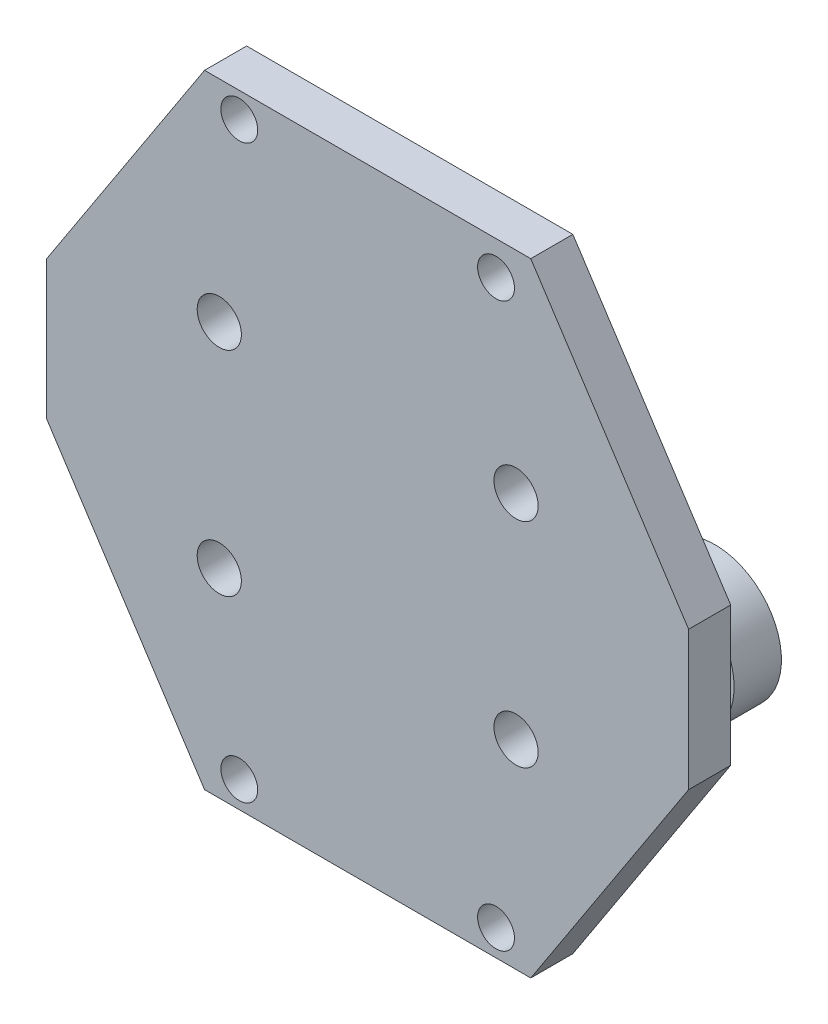
from build123d import *

# Parameters (mm, degrees)
CROQUIS1_W               = 22
CROQUIS1_H               = 55.2
SALIENTE_EXTRUIR1_DEPTH  = 4
CROQUIS2_W               = 12.1
CROQUIS2_H               = 4
CORTAR_EXTRUIR1_DEPTH    = 9.6
CROQUIS3_W               = 12.1
CROQUIS3_H               = 4
CORTAR_EXTRUIR2_DEPTH    = 9.6
CORTAR_EXTRUIR3_DEPTH    = 16
CORTAR_EXTRUIR4_START    = -16
CORTAR_EXTRUIR4_DEPTH    = 16
CROQUIS9_W               = 11.778481694
CROQUIS9_H               = 4
CORTAR_EXTRUIR5_DEPTH    = 2
CROQUIS11_W              = 4.95
CROQUIS11_H              = 4
SALIENTE_EXTRUIR3_DEPTH  = 2
CROQUIS12_W              = 4
CROQUIS12_H              = 1.8
SALIENTE_EXTRUIR4_DEPTH  = 12.1
CROQUIS13_W              = 4.95
CROQUIS13_H              = 4
SALIENTE_EXTRUIR5_DEPTH  = 2
CROQUIS14_W              = 4
CROQUIS14_H              = 1.8
SALIENTE_EXTRUIR6_DEPTH  = 12.1
CROQUIS17_W              = 4
CROQUIS17_H              = 59.2
SALIENTE_EXTRUIR8_DEPTH  = 11.5
CROQUIS18_W              = 4
CROQUIS18_H              = 59.2
SALIENTE_EXTRUIR9_DEPTH  = 11.5
CROQUIS19_R              = 1.75
CORTAR_EXTRUIR6_DEPTH    = 11.5
CROQUIS27_W              = 12.1
CROQUIS27_H              = 55.6
CORTAR_EXTRUIR8_DEPTH    = 10
CROQUIS28_W              = 12.1
CROQUIS28_H              = 4
SALIENTE_EXTRUIR10_DEPTH = 55.6
CROQUIS33_W              = 4
CROQUIS33_H              = 59.2
SALIENTE_EXTRUIR13_DEPTH = 8
CROQUIS30_R              = 2.1
CORTAR_EXTRUIR9_DEPTH    = 10
CROQUIS32_W              = 4
CROQUIS32_H              = 59.2
SALIENTE_EXTRUIR12_DEPTH = 8
SALIENTE_EXTRUIR11_DEPTH = 4.5
CORTAR_EXTRUIR10_DEPTH   = 8


with BuildPart() as part:
    # Croquis1 → Saliente-Extruir1 (new body)
    with BuildSketch(Plane.XY):
        with Locations((11, 27.6)):
            Rectangle(CROQUIS1_W, CROQUIS1_H)
    extrude(amount=SALIENTE_EXTRUIR1_DEPTH)

    # Croquis2 → Cortar-Extruir1 (cut)
    with BuildSketch(Plane(origin=(0, 55.2, 0), x_dir=(1, 0, 0), z_dir=(0, 1, 0))):
        with Locations((11, -2)):
            Rectangle(CROQUIS2_W, CROQUIS2_H)
    extrude(amount=-CORTAR_EXTRUIR1_DEPTH, mode=Mode.SUBTRACT)

    # Croquis3 → Cortar-Extruir2 (cut)
    with BuildSketch(Plane.XZ):
        with Locations((11, 2)):
            Rectangle(CROQUIS3_W, CROQUIS3_H)
    extrude(amount=-CORTAR_EXTRUIR2_DEPTH, mode=Mode.SUBTRACT)

    # Croquis5 → Cortar-Extruir3 (cut)
    with BuildSketch(Plane.XZ.offset(-9.6)):
        with BuildLine():
            Line((7.4, 4), (14.6, 4))
            ThreePointArc((14.6, 4), (16.401151853, 1.506649462), (17.05, -1.5))
            Line((17.05, -1.5), (4.95, -1.5))
            ThreePointArc((4.95, -1.5), (5.598848147, 1.506649462), (7.4, 4))
        make_face()
    extrude(amount=-CORTAR_EXTRUIR3_DEPTH, mode=Mode.SUBTRACT)

    # Croquis7 → Cortar-Extruir4 (cut)
    with BuildSketch(Plane(origin=(0, 45.6, 0), x_dir=(1, 0, 0), z_dir=(0, 1, 0)).offset(CORTAR_EXTRUIR4_START)):
        with BuildLine():
            Line((4.95, 1.5), (17.05, 1.5))
            ThreePointArc((17.05, 1.5), (16.401151853, -1.506649462), (14.6, -4))
            Line((14.6, -4), (7.4, -4))
            ThreePointArc((7.4, -4), (5.598848147, -1.506649462), (4.95, 1.5))
        make_face()
    extrude(amount=CORTAR_EXTRUIR4_DEPTH, mode=Mode.SUBTRACT)

    # Croquis9 → Cortar-Extruir5 (cut)
    with BuildSketch(Plane(origin=(0, 0, 0), x_dir=(-1, 0, 0), z_dir=(0, 0, -1))):
        with Locations((-11, 27.6)):
            Rectangle(CROQUIS9_W, CROQUIS9_H)
    extrude(amount=-CORTAR_EXTRUIR5_DEPTH, mode=Mode.SUBTRACT)

    # Croquis11 → Saliente-Extruir3 (add)
    with BuildSketch(Plane(origin=(0, 55.2, 0), x_dir=(1, 0, 0), z_dir=(0, 1, 0))):
        with Locations((2.475, -2)):
            Rectangle(CROQUIS11_W, CROQUIS11_H)
        with Locations((19.525, -2)):
            Rectangle(CROQUIS11_W, CROQUIS11_H)
    extrude(amount=SALIENTE_EXTRUIR3_DEPTH)

    # Croquis12 → Saliente-Extruir4 (add)
    with BuildSketch(Plane(origin=(4.95, 0, 0), x_dir=(0, 0, -1), z_dir=(1, 0, 0))):
        with Locations((-2, 56.3)):
            Rectangle(CROQUIS12_W, CROQUIS12_H)
    extrude(amount=SALIENTE_EXTRUIR4_DEPTH)

    # Croquis13 → Saliente-Extruir5 (add)
    with BuildSketch(Plane.XZ):
        with Locations((19.525, 2)):
            Rectangle(CROQUIS13_W, CROQUIS13_H)
        with Locations((2.475, 2)):
            Rectangle(CROQUIS13_W, CROQUIS13_H)
    extrude(amount=SALIENTE_EXTRUIR5_DEPTH)

    # Croquis14 → Saliente-Extruir6 (add)
    with BuildSketch(Plane(origin=(4.95, 0, 0), x_dir=(0, 0, -1), z_dir=(1, 0, 0))):
        with Locations((-2, -1.1)):
            Rectangle(CROQUIS14_W, CROQUIS14_H)
    extrude(amount=SALIENTE_EXTRUIR6_DEPTH)

    # Croquis17 → Saliente-Extruir8 (add)
    with BuildSketch(Plane.ZY):
        with Locations((2, 27.6)):
            Rectangle(CROQUIS17_W, CROQUIS17_H)
    extrude(amount=SALIENTE_EXTRUIR8_DEPTH)

    # Croquis18 → Saliente-Extruir9 (add)
    with BuildSketch(Plane(origin=(22, 0, 0), x_dir=(0, 0, -1), z_dir=(1, 0, 0))):
        with Locations((-2, 27.6)):
            Rectangle(CROQUIS18_W, CROQUIS18_H)
    extrude(amount=SALIENTE_EXTRUIR9_DEPTH)

    # Croquis19 → Cortar-Extruir6 (cut)
    with BuildSketch(Plane(origin=(0, 0, 0), x_dir=(-1, 0, 0), z_dir=(0, 0, -1))):
        with Locations((-23.2, 54)):
            Circle(CROQUIS19_R)
        with Locations((1.2, 54.8)):
            Circle(CROQUIS19_R)
        with Locations((1.2, 0.5)):
            Circle(CROQUIS19_R)
        with Locations((-23.2, 0.5)):
            Circle(CROQUIS19_R)
    extrude(amount=-CORTAR_EXTRUIR6_DEPTH, mode=Mode.SUBTRACT)

    # Croquis27 → Cortar-Extruir8 (cut)
    with BuildSketch(Plane(origin=(0, 0, 0), x_dir=(-1, 0, 0), z_dir=(0, 0, -1))):
        with Locations((-11, 27.6)):
            Rectangle(CROQUIS27_W, CROQUIS27_H)
    extrude(amount=-CORTAR_EXTRUIR8_DEPTH, mode=Mode.SUBTRACT)

    # Croquis28 → Saliente-Extruir10 (add)
    with BuildSketch(Plane.XZ.offset(-55.4)):
        with Locations((11, 2)):
            Rectangle(CROQUIS28_W, CROQUIS28_H)
    extrude(amount=SALIENTE_EXTRUIR10_DEPTH)

    # Croquis33 → Saliente-Extruir13 (add)
    with BuildSketch(Plane.ZY.offset(11.5)):
        with Locations((2, 27.6)):
            Rectangle(CROQUIS33_W, CROQUIS33_H)
    extrude(amount=SALIENTE_EXTRUIR13_DEPTH)

    # Croquis30 → Cortar-Extruir9 (cut)
    with BuildSketch(Plane(origin=(0, 0, 0), x_dir=(-1, 0, 0), z_dir=(0, 0, -1))):
        with Locations((-25.1, 37.194789274)):
            Circle(CROQUIS30_R)
        with Locations((-25.1, 16.925277734)):
            Circle(CROQUIS30_R)
        with Locations((3.1, 37.194789274)):
            Circle(CROQUIS30_R)
        with Locations((3.1, 16.925277734)):
            Circle(CROQUIS30_R)
    extrude(amount=-CORTAR_EXTRUIR9_DEPTH, mode=Mode.SUBTRACT)

    # Croquis32 → Saliente-Extruir12 (add)
    with BuildSketch(Plane(origin=(33.5, 0, 0), x_dir=(0, 0, -1), z_dir=(1, 0, 0))):
        with Locations((-2, 27.6)):
            Rectangle(CROQUIS32_W, CROQUIS32_H)
    extrude(amount=SALIENTE_EXTRUIR12_DEPTH)

    # Croquis29 → Saliente-Extruir11 (add)
    with BuildSketch(Plane(origin=(0, 0, 0), x_dir=(-1, 0, 0), z_dir=(0, 0, -1))):
        with BuildLine():
            Line((-32.099895832, 32.201901781), (-32.099895832, 22.998098219))
            Line((-32.099895832, 22.998098219), (-32.099895832, 22.27255299))
            ThreePointArc((-32.099895832, 22.27255299), (-41.82, 27.6), (-32.099895832, 32.92744701))
            Line((-32.099895832, 32.92744701), (-32.099895832, 32.201901781))
        make_face()
        with BuildLine():
            Line((8.83711623, 23.32791238), (8.83711623, 31.87208762))
            ThreePointArc((8.83711623, 31.87208762), (19.824019109, 27.6), (8.83711623, 23.32791238))
        make_face()
    extrude(amount=SALIENTE_EXTRUIR11_DEPTH)

    # Croquis35 → Cortar-Revolución1 (revolve, cut)
    with BuildSketch(Plane(origin=(0, 0, -7.5), x_dir=(-1, 0, 0), z_dir=(0, 0, -1))):
        with BuildLine():
            Line((-35.5, 32.6), (-35.5, 22.6))
            ThreePointArc((-35.5, 22.6), (-40.5, 27.6), (-35.5, 32.6))
        make_face()
    revolve(axis=Axis((35.5, 32.6, -7.5), (0, -1, 0)), mode=Mode.SUBTRACT)

    # Croquis36 → Cortar-Revolución2 (revolve, cut)
    with BuildSketch(Plane(origin=(0, 0, -7.5), x_dir=(-1, 0, 0), z_dir=(0, 0, -1))):
        with BuildLine():
            Line((13.5, 32.6), (13.5, 22.6))
            ThreePointArc((13.5, 22.6), (18.5, 27.6), (13.5, 32.6))
        make_face()
    revolve(axis=Axis((-13.5, 32.6, -7.5), (0, -1, 0)), mode=Mode.SUBTRACT)

    # Croquis37 → Cortar-Extruir10 (cut)
    with BuildSketch(Plane.XY.offset(4)):
        Polygon((-19.5, 57.2), (-19.5, 34.2), (-4.5, 57.2), align=None)
        Polygon((41.5, 57.2), (26.5, 57.2), (41.5, 34.2), align=None)
        Polygon((-19.5, -2), (-19.5, 21), (-4.5, -2), align=None)
        Polygon((41.5, -2), (41.5, 21), (26.5, -2), align=None)
    extrude(amount=-CORTAR_EXTRUIR10_DEPTH, mode=Mode.SUBTRACT)


solid = part.part
